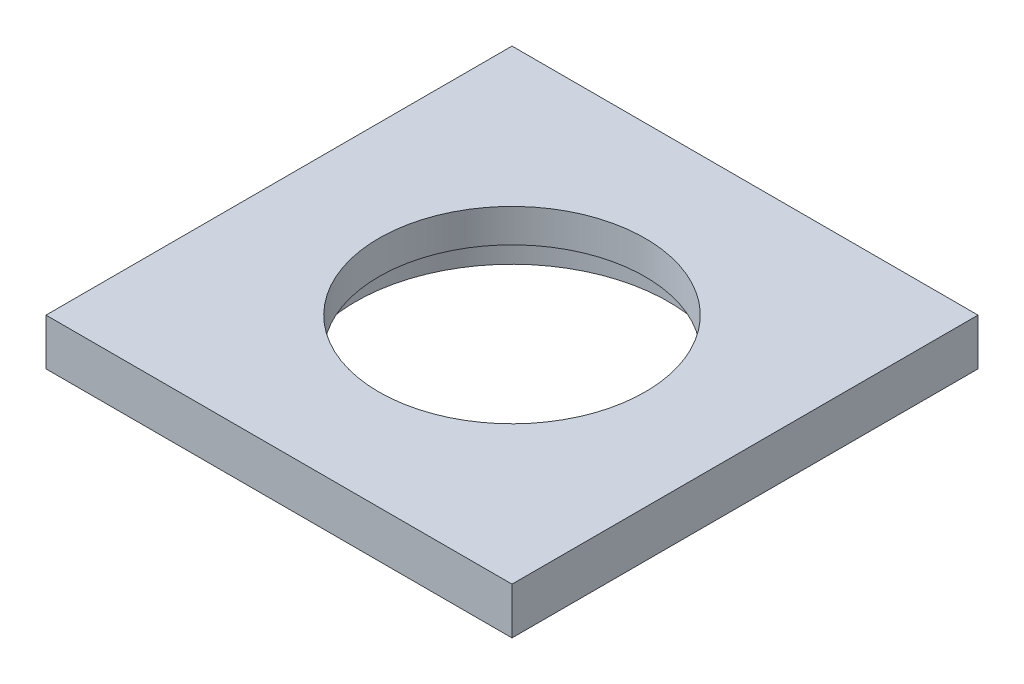
from build123d import *

# Parameters (mm, degrees)
SZKIC1_W                    = 70
SZKIC1_H                    = 70
SZKIC1_R                    = 20
DODANIE_WYCI_GNI_CIE1_DEPTH = 10
SZKIC1_3_W                  = 70
SZKIC1_3_H                  = 70
WYTNIJ_WYCI_GNI_CIE1_DEPTH  = 3
SZKIC1_4_R                  = 23.5
SZKIC1_4_R_2                = 20
WYTNIJ_WYCI_GNI_CIE2_DEPTH  = 5


with BuildPart() as part:
    # Szkic1 → Dodanie-wyciągnięcie1 (new body)
    with BuildSketch(Plane(origin=(0, 0, 0), x_dir=(1, 0, 0), z_dir=(0, 1, 0))):
        with Locations((35, 35)):
            Rectangle(SZKIC1_W, SZKIC1_H)
        with Locations((35, 35)):
            Circle(SZKIC1_R, mode=Mode.SUBTRACT)
    extrude(amount=DODANIE_WYCI_GNI_CIE1_DEPTH)

    # Szkic1<3> → Wytnij-wyciągnięcie1 (cut)
    with BuildSketch(Plane(origin=(0, 0, 0), x_dir=(1, 0, 0), z_dir=(0, 1, 0))):
        with Locations((35, 35)):
            Rectangle(SZKIC1_3_W, SZKIC1_3_H)
        with BuildLine():
            Line((5, 15), (5, 35))
            Line((5, 35), (5, 55))
            ThreePointArc((5, 55), (7.928932188, 62.071067812), (15, 65))
            Line((15, 65), (55, 65))
            ThreePointArc((55, 65), (62.071067812, 62.071067812), (65, 55))
            Line((65, 55), (65, 15))
            ThreePointArc((65, 15), (62.071067812, 7.928932188), (55, 5))
            Line((55, 5), (15, 5))
            ThreePointArc((15, 5), (7.928932188, 7.928932188), (5, 15))
        make_face(mode=Mode.SUBTRACT)
    extrude(amount=WYTNIJ_WYCI_GNI_CIE1_DEPTH, mode=Mode.SUBTRACT)

    # Szkic1<4> → Wytnij-wyciągnięcie2 (cut)
    with BuildSketch(Plane(origin=(0, 0, 0), x_dir=(1, 0, 0), z_dir=(0, 1, 0))):
        with Locations((35, 35)):
            Circle(SZKIC1_4_R)
        with Locations((35, 35)):
            Circle(SZKIC1_4_R_2, mode=Mode.SUBTRACT)
    extrude(amount=WYTNIJ_WYCI_GNI_CIE2_DEPTH, mode=Mode.SUBTRACT)


solid = part.part
